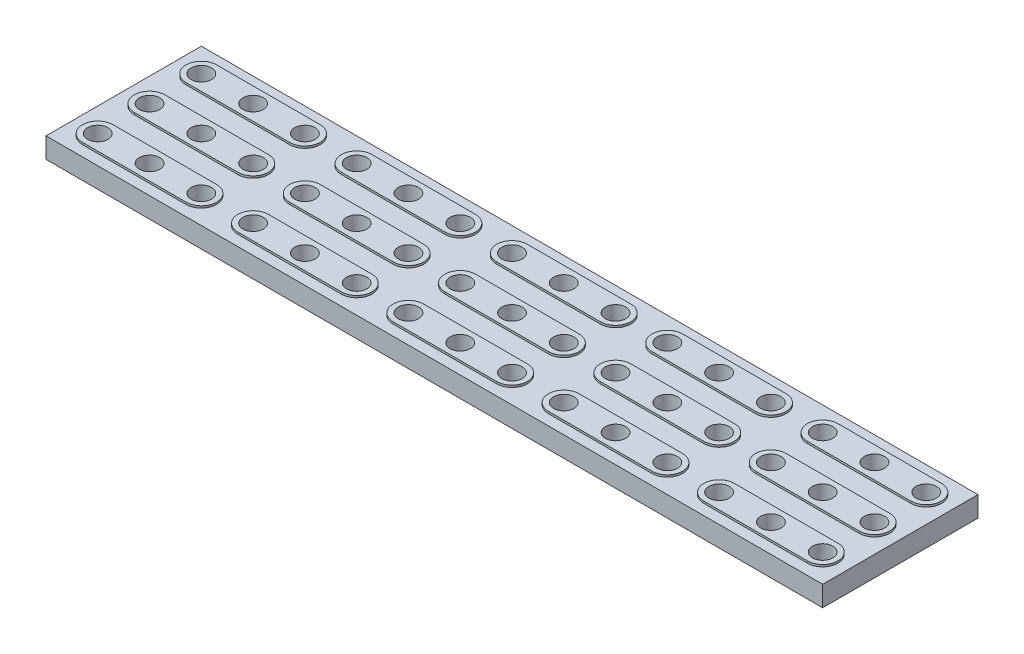
from build123d import *

# Parameters (mm, degrees)
SKETCH1_R            = 0.5
BOSS_EXTRUDE1_DEPTH  = 0.1
SKETCH2_W            = 38.1
SKETCH2_H            = 7.62
BOSS_EXTRUDE2_DEPTH  = 1
LPATTERN2_COUNT      = 5
LPATTERN2_PITCH      = 7.62
LPATTERN2_COUNT_DIR2 = 3
LPATTERN2_PITCH_DIR2 = 2.54
SKETCH3_R            = 0.5
CUT_EXTRUDE1_DEPTH   = 38.386781086


with BuildPart() as part:
    # Sketch1 → Boss-Extrude1 (new body)
    with BuildSketch(Plane(origin=(0, 0, 0), x_dir=(1, 0, 0), z_dir=(0, 1, 0))):
        with BuildLine():
            Line((0, 0.75), (5.08, 0.75))
            ThreePointArc((5.08, 0.75), (5.83, 0), (5.08, -0.75))
            Line((5.08, -0.75), (0, -0.75))
            ThreePointArc((0, -0.75), (-0.75, 0), (0, 0.75))
        make_face()
        with Locations(Location((0, 0, 0), (0, 0, 270))):
            Circle(SKETCH1_R, mode=Mode.SUBTRACT)
        with Locations(Location((2.54, 0, 0), (0, 0, 270))):
            Circle(SKETCH1_R, mode=Mode.SUBTRACT)
        with Locations(Location((5.08, 0, 0), (0, 0, 270))):
            Circle(SKETCH1_R, mode=Mode.SUBTRACT)
    boss_extrude1 = extrude(amount=BOSS_EXTRUDE1_DEPTH)

    # Sketch2 → Boss-Extrude2 (add)
    with BuildSketch(Plane(origin=(0, 0, 0), x_dir=(1, 0, 0), z_dir=(0, 1, 0))):
        with Locations((17.78, 2.54)):
            Rectangle(SKETCH2_W, SKETCH2_H)
    extrude(amount=-BOSS_EXTRUDE2_DEPTH)

    # LPattern2: Boss-Extrude1 5 × 3
    with Locations(*[(i * LPATTERN2_PITCH, 0, -j * LPATTERN2_PITCH_DIR2) for i in range(LPATTERN2_COUNT) for j in range(LPATTERN2_COUNT_DIR2) if (i, j) != (0, 0)]):
        add(boss_extrude1)

    # Sketch3 → Cut-Extrude1 (cut, through all)
    with BuildSketch(Plane(origin=(0, 0, 0), x_dir=(1, 0, 0), z_dir=(0, 1, 0))):
        with Locations(Location((0, 0, 0), (0, 0, 270))):
            Circle(SKETCH3_R)
        with Locations(Location((2.54, 0, 0), (0, 0, 270))):
            Circle(SKETCH3_R)
        with Locations(Location((5.08, 0, 0), (0, 0, 270))):
            Circle(SKETCH3_R)
        with Locations(Location((7.62, 0, 0), (0, 0, 270))):
            Circle(SKETCH3_R)
        with Locations(Location((10.16, 0, 0), (0, 0, 270))):
            Circle(SKETCH3_R)
        with Locations(Location((12.7, 0, 0), (0, 0, 270))):
            Circle(SKETCH3_R)
        with Locations(Location((15.24, 0, 0), (0, 0, 270))):
            Circle(SKETCH3_R)
        with Locations(Location((17.78, 0, 0), (0, 0, 270))):
            Circle(SKETCH3_R)
        with Locations(Location((20.32, 0, 0), (0, 0, 270))):
            Circle(SKETCH3_R)
        with Locations(Location((22.86, 0, 0), (0, 0, 270))):
            Circle(SKETCH3_R)
        with Locations(Location((25.4, 0, 0), (0, 0, 270))):
            Circle(SKETCH3_R)
        with Locations(Location((27.94, 0, 0), (0, 0, 270))):
            Circle(SKETCH3_R)
        with Locations(Location((30.48, 0, 0), (0, 0, 270))):
            Circle(SKETCH3_R)
        with Locations(Location((33.02, 0, 0), (0, 0, 270))):
            Circle(SKETCH3_R)
        with Locations(Location((35.56, 0, 0), (0, 0, 270))):
            Circle(SKETCH3_R)
        with Locations(Location((0, 2.54, 0), (0, 0, 270))):
            Circle(SKETCH3_R)
        with Locations(Location((2.54, 2.54, 0), (0, 0, 270))):
            Circle(SKETCH3_R)
        with Locations(Location((5.08, 2.54, 0), (0, 0, 270))):
            Circle(SKETCH3_R)
        with Locations(Location((7.62, 2.54, 0), (0, 0, 270))):
            Circle(SKETCH3_R)
        with Locations(Location((10.16, 2.54, 0), (0, 0, 270))):
            Circle(SKETCH3_R)
        with Locations(Location((12.7, 2.54, 0), (0, 0, 270))):
            Circle(SKETCH3_R)
        with Locations(Location((15.24, 2.54, 0), (0, 0, 270))):
            Circle(SKETCH3_R)
        with Locations(Location((17.78, 2.54, 0), (0, 0, 270))):
            Circle(SKETCH3_R)
        with Locations(Location((20.32, 2.54, 0), (0, 0, 270))):
            Circle(SKETCH3_R)
        with Locations(Location((22.86, 2.54, 0), (0, 0, 270))):
            Circle(SKETCH3_R)
        with Locations(Location((25.4, 2.54, 0), (0, 0, 270))):
            Circle(SKETCH3_R)
        with Locations(Location((27.94, 2.54, 0), (0, 0, 270))):
            Circle(SKETCH3_R)
        with Locations(Location((30.48, 2.54, 0), (0, 0, 270))):
            Circle(SKETCH3_R)
        with Locations(Location((33.02, 2.54, 0), (0, 0, 270))):
            Circle(SKETCH3_R)
        with Locations(Location((35.56, 2.54, 0), (0, 0, 270))):
            Circle(SKETCH3_R)
        with Locations(Location((0, 5.08, 0), (0, 0, 270))):
            Circle(SKETCH3_R)
        with Locations(Location((2.54, 5.08, 0), (0, 0, 270))):
            Circle(SKETCH3_R)
        with Locations(Location((5.08, 5.08, 0), (0, 0, 270))):
            Circle(SKETCH3_R)
        with Locations(Location((7.62, 5.08, 0), (0, 0, 270))):
            Circle(SKETCH3_R)
        with Locations(Location((10.16, 5.08, 0), (0, 0, 270))):
            Circle(SKETCH3_R)
        with Locations(Location((12.7, 5.08, 0), (0, 0, 270))):
            Circle(SKETCH3_R)
        with Locations(Location((15.24, 5.08, 0), (0, 0, 270))):
            Circle(SKETCH3_R)
        with Locations(Location((17.78, 5.08, 0), (0, 0, 270))):
            Circle(SKETCH3_R)
        with Locations(Location((20.32, 5.08, 0), (0, 0, 270))):
            Circle(SKETCH3_R)
        with Locations(Location((22.86, 5.08, 0), (0, 0, 270))):
            Circle(SKETCH3_R)
        with Locations(Location((25.4, 5.08, 0), (0, 0, 270))):
            Circle(SKETCH3_R)
        with Locations(Location((27.94, 5.08, 0), (0, 0, 270))):
            Circle(SKETCH3_R)
        with Locations(Location((30.48, 5.08, 0), (0, 0, 270))):
            Circle(SKETCH3_R)
        with Locations(Location((33.02, 5.08, 0), (0, 0, 270))):
            Circle(SKETCH3_R)
        with Locations(Location((35.56, 5.08, 0), (0, 0, 270))):
            Circle(SKETCH3_R)
    extrude(amount=-CUT_EXTRUDE1_DEPTH, mode=Mode.SUBTRACT)


solid = part.part
